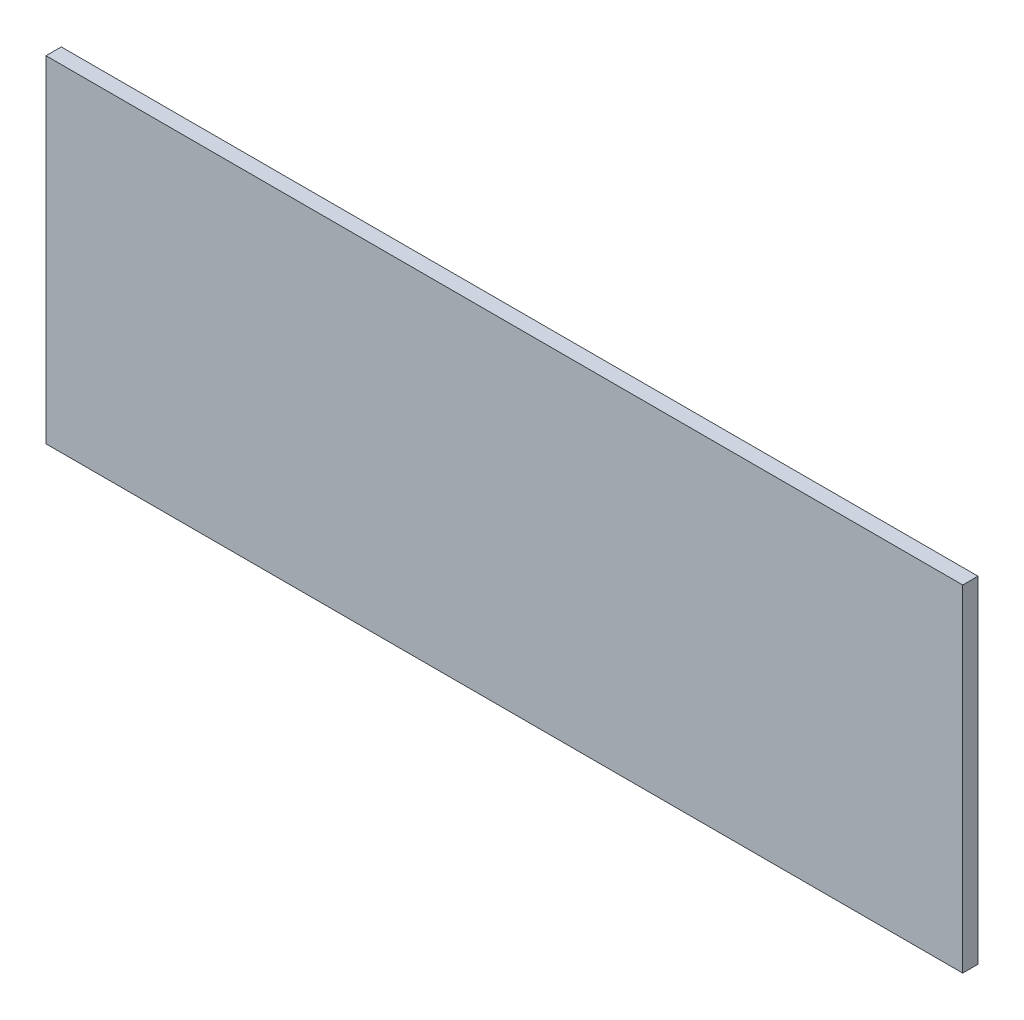
from build123d import *

# Parameters (mm, degrees)
SKETCH1_W           = 180
SKETCH1_H           = 66
BOSS_EXTRUDE1_DEPTH = 3


with BuildPart() as part:
    # Sketch1 → Boss-Extrude1 (new body)
    with BuildSketch(Plane.XY):
        Rectangle(SKETCH1_W, SKETCH1_H)
    extrude(amount=BOSS_EXTRUDE1_DEPTH)


solid = part.part
